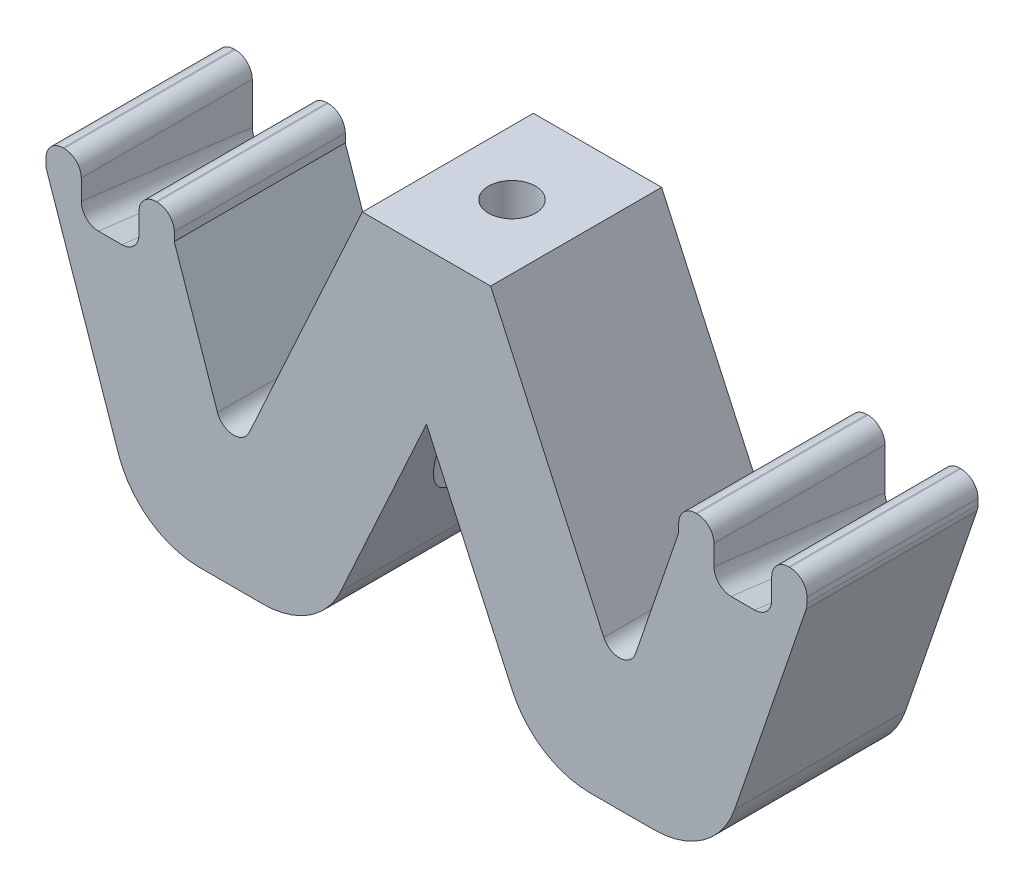
from build123d import *

# Parameters (mm, degrees)
SKETCH1_R           = 4
BOSS_EXTRUDE1_DEPTH = 20
FILLET1_R           = 10
SKETCH2_W           = 6.75
SKETCH2_H           = 6.75
CUT_EXTRUDE1_DEPTH  = 122.829645635
SKETCH3_W           = 4.125
SKETCH3_H           = 20
BOSS_EXTRUDE2_DEPTH = 3
FILLET2_R           = 2
BOSS_EXTRUDE3_DEPTH = 20
SKETCH6_W           = 140
SKETCH6_H           = 64.976574758
CUT_EXTRUDE3_DEPTH  = 133.326301241
SKETCH7_R           = 6.5
CUT_EXTRUDE4_DEPTH  = 35.523425242
FILLET5_R           = 2
FILLET6_R           = 10
SKETCH8_R           = 2.75
CUT_EXTRUDE5_DEPTH  = 61.35034168


with BuildPart() as part:
    # Sketch1 → Boss-Extrude1 (new body)
    with BuildSketch(Plane.XY):
        with BuildLine():
            Line((-70, 0), (70, 0))
            Line((70, 0), (70, 12))
            ThreePointArc((70, 12), (66.338834765, 20.838834765), (57.5, 24.5))
            Line((57.5, 24.5), (25, 24.5))
            Line((25, 24.5), (25, 39.5))
            Line((25, 39.5), (44.5, 96.5))
            Line((44.5, 96.5), (29.5, 96.5))
            Line((29.5, 96.5), (0, 10.269230769))
            Line((0, 10.269230769), (-29.5, 96.5))
            Line((-29.5, 96.5), (-44.5, 96.5))
            Line((-44.5, 96.5), (-25, 39.5))
            Line((-25, 39.5), (-25, 24.5))
            Line((-25, 24.5), (-57.5, 24.5))
            ThreePointArc((-57.5, 24.5), (-66.338834765, 20.838834765), (-70, 12))
            Line((-70, 12), (-70, 0))
        make_face()
        with Locations((-57.5, 12)):
            Circle(SKETCH1_R, mode=Mode.SUBTRACT)
        with Locations(Location((57.5, 12, 0), (0, 0, 180))):
            Circle(SKETCH1_R, mode=Mode.SUBTRACT)
    extrude(amount=BOSS_EXTRUDE1_DEPTH)

    # Fillet1
    fillet1_edges = [part.edges().sort_by_distance(p)[0] for p in [
        (25, 39.5, 10),
        (25, 24.5, 10),
        (-25, 24.5, 10),
        (-25, 39.5, 10),
        (0, 10.269230769, 10),
    ]]
    fillet(fillet1_edges, radius=FILLET1_R)

    # Sketch2 → Cut-Extrude1 (cut, through all, along a direction that is not the sketch's normal)
    with BuildSketch(Plane.XY.offset(20)):
        with Locations((37, 96.5)):
            Rectangle(SKETCH2_W, SKETCH2_H)
        with Locations((-37, 96.5)):
            Rectangle(SKETCH2_W, SKETCH2_H)
    extrude(amount=-CUT_EXTRUDE1_DEPTH, dir=(0, 0.12403473458920856, 0.9922778767136676), mode=Mode.SUBTRACT)

    # Sketch3 → Boss-Extrude2 (add)
    with BuildSketch(Plane(origin=(0, 96.5, 0), x_dir=(1, 0, 0), z_dir=(0, 1, 0))):
        with Locations((42.4375, -10)):
            Rectangle(SKETCH3_W, SKETCH3_H)
        with Locations((31.5625, -10)):
            Rectangle(SKETCH3_W, SKETCH3_H)
        with Locations((-31.5625, -10)):
            Rectangle(SKETCH3_W, SKETCH3_H)
        with Locations((-42.4375, -10)):
            Rectangle(SKETCH3_W, SKETCH3_H)
    extrude(amount=BOSS_EXTRUDE2_DEPTH)

    # Fillet2
    fillet2_edges = [part.edges().sort_by_distance(p)[0] for p in [
        (40.375, 91.875, 10),
        (33.625, 91.875, 10),
        (44.5, 99.5, 10),
        (40.375, 99.5, 10),
        (29.5, 99.5, 10),
        (33.625, 99.5, 10),
        (-29.5, 99.5, 10),
        (-33.625, 99.5, 10),
        (-44.5, 99.5, 10),
        (-40.375, 99.5, 10),
        (44.5, 96.5, 10),
        (-33.625, 91.875, 10),
        (-40.375, 91.875, 10),
    ]]
    fillet(fillet2_edges, radius=FILLET2_R)

    # Sketch4 → Boss-Extrude3 (add)
    with BuildSketch(Plane.XY.offset(20)):
        Polygon((-22.82093347, 76.976574758), (-7.5, 110.5), (7.5, 110.5), (22.82093347, 76.976574758), (16.14070638, 57.44975711), (0, 92.766910908), (-16.14070638, 57.44975711), align=None)
    extrude(amount=-BOSS_EXTRUDE3_DEPTH)

    # Sketch6 → Cut-Extrude3 (cut, through all)
    with BuildSketch(Plane.XY.offset(20)):
        with Locations((0, 32.488287379)):
            Rectangle(SKETCH6_W, SKETCH6_H)
    extrude(amount=-CUT_EXTRUDE3_DEPTH, mode=Mode.SUBTRACT)

    # Sketch7 → Cut-Extrude4 (cut)
    with BuildSketch(Plane.XZ.offset(-64.976574758)):
        with Locations(Location((0, 10, 0), (0, 0, 90))):
            Circle(SKETCH7_R)
    extrude(amount=-CUT_EXTRUDE4_DEPTH, mode=Mode.SUBTRACT)

    # Fillet5
    fillet5_edges = [part.edges().sort_by_distance(p)[0] for p in [
        (22.82093347, 76.976574758, 10),
        (-22.82093347, 76.976574758, 10),
    ]]
    fillet(fillet5_edges, radius=FILLET5_R)

    # Fillet6
    fillet6_edges = [part.edges().sort_by_distance(p)[0] for p in [
        (12.700787231, 64.976574758, 10),
        (-33.715670312, 64.976574758, 10),
        (33.715670312, 64.976574758, 10),
        (-12.700787231, 64.976574758, 10),
    ]]
    fillet(fillet6_edges, radius=FILLET6_R)

    # Sketch8 → Cut-Extrude5 (cut, through all)
    with BuildSketch(Plane.XZ.offset(-100.5)):
        with Locations(Location((0, 10, 0), (0, 0, 270))):
            Circle(SKETCH8_R)
    extrude(amount=-CUT_EXTRUDE5_DEPTH, mode=Mode.SUBTRACT)


solid = part.part
